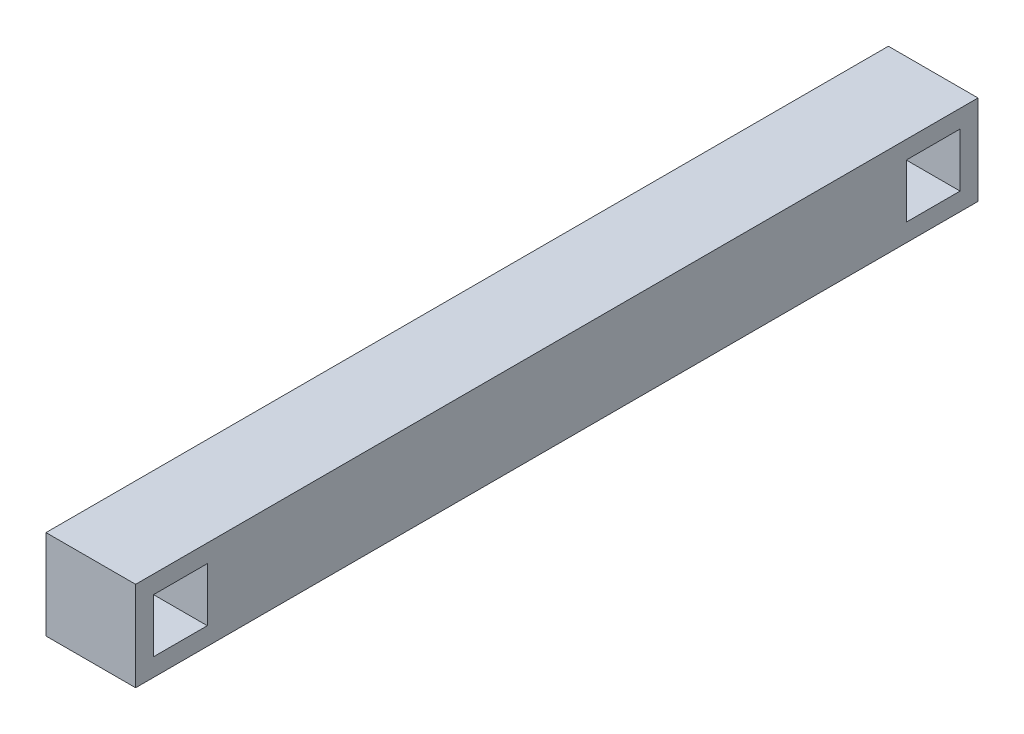
from build123d import *

# Parameters (mm, degrees)
SKETCH1_W           = 5
SKETCH1_H           = 5
BOSS_EXTRUDE1_DEPTH = 47
SKETCH2_W           = 3
SKETCH2_H           = 3
CUT_EXTRUDE1_DEPTH  = 47


with BuildPart() as part:
    # Sketch1 → Boss-Extrude1 (new body)
    with BuildSketch(Plane.XY):
        with Locations((2.5, 2.5)):
            Rectangle(SKETCH1_W, SKETCH1_H)
    extrude(amount=BOSS_EXTRUDE1_DEPTH)

    # Sketch2 → Cut-Extrude1 (cut)
    with BuildSketch(Plane(origin=(5, 0, 0), x_dir=(0, 0, -1), z_dir=(1, 0, 0))):
        with Locations((-44.5, 2.5)):
            Rectangle(SKETCH2_W, SKETCH2_H)
        with Locations((-2.5, 2.5)):
            Rectangle(SKETCH2_W, SKETCH2_H)
    extrude(amount=-CUT_EXTRUDE1_DEPTH, mode=Mode.SUBTRACT)


solid = part.part
